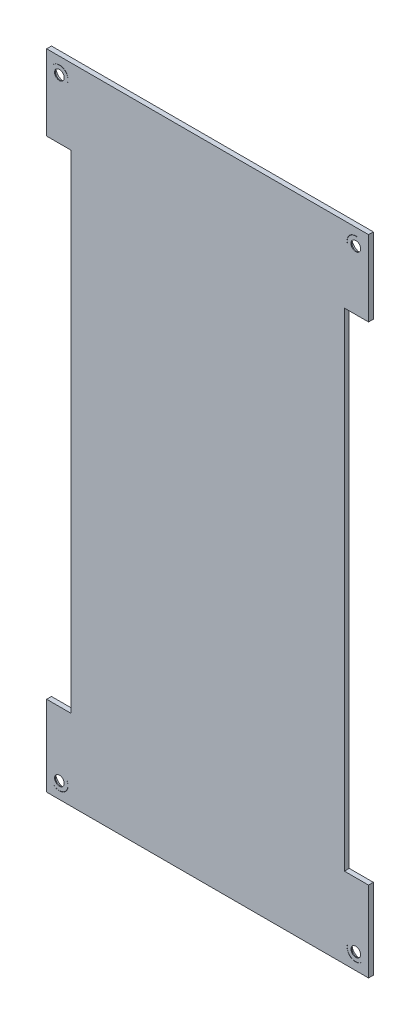
from build123d import *

# Parameters (mm, degrees)
SKETCH2_W           = 100
SKETCH2_H           = 200
BOSS_EXTRUDE1_DEPTH = 1.5
SKETCH4_R           = 2.667
CUT_EXTRUDE1_DEPTH  = 2
SKETCH5_R           = 2.667
SKETCH5_R_2         = 1.5
BOSS_EXTRUDE2_DEPTH = 0.254
SKETCH6_W           = 7.5
SKETCH6_H           = 150
CUT_EXTRUDE2_DEPTH  = 1.5
SKETCH7_W           = 7.5
SKETCH7_H           = 1.5
CUT_EXTRUDE3_DEPTH  = 1.5


with BuildPart() as part:
    # Sketch2 → Boss-Extrude1 (new body)
    with BuildSketch(Plane.XY):
        with Locations((50, 100)):
            Rectangle(SKETCH2_W, SKETCH2_H)
    extrude(amount=BOSS_EXTRUDE1_DEPTH)

    # Sketch4 → Cut-Extrude1 (cut)
    with BuildSketch(Plane.XY.offset(1.5)):
        with Locations((4, 195)):
            Circle(SKETCH4_R)
        with Locations((96, 195)):
            Circle(SKETCH4_R)
        with Locations((96, 5)):
            Circle(SKETCH4_R)
        with Locations((4, 5)):
            Circle(SKETCH4_R)
    extrude(amount=-CUT_EXTRUDE1_DEPTH, mode=Mode.SUBTRACT)

    # Sketch5 → Boss-Extrude2 (add)
    # profile 1 of 4: a face of its own
    with BuildSketch(Plane.XY.offset(1.5)):
        with Locations((3.959685834, 5.068811707)):
            Circle(SKETCH5_R)
        with Locations(Location((3.959685834, 5.068811707, 0), (0, 0, 180))):
            Circle(SKETCH5_R_2, mode=Mode.SUBTRACT)
    # profile 2 of 4: a face of its own
    with BuildSketch(Plane.XY.offset(1.5)):
        with Locations((3.959685834, 194.931188293)):
            Circle(SKETCH5_R)
        with Locations((3.959685834, 194.931188293)):
            Circle(SKETCH5_R_2, mode=Mode.SUBTRACT)
    # profile 3 of 4: a face of its own
    with BuildSketch(Plane.XY.offset(1.5)):
        with Locations((96.040314166, 5.068811707)):
            Circle(SKETCH5_R)
        with Locations((96.040314166, 5.068811707)):
            Circle(SKETCH5_R_2, mode=Mode.SUBTRACT)
    # profile 4 of 4: a face of its own
    with BuildSketch(Plane.XY.offset(1.5)):
        with Locations((96.040314166, 194.931188293)):
            Circle(SKETCH5_R)
        with Locations(Location((96.040314166, 194.931188293, 0), (0, 0, 180))):
            Circle(SKETCH5_R_2, mode=Mode.SUBTRACT)
    extrude(amount=-BOSS_EXTRUDE2_DEPTH)

    # Sketch6 → Cut-Extrude2 (cut)
    with BuildSketch(Plane.XY):
        with Locations((3.75, 100)):
            Rectangle(SKETCH6_W, SKETCH6_H)
        with Locations((96.25, 100)):
            Rectangle(SKETCH6_W, SKETCH6_H)
    extrude(amount=CUT_EXTRUDE2_DEPTH, mode=Mode.SUBTRACT)

    # Sketch7 → Cut-Extrude3 (cut)
    with BuildSketch(Plane.XZ.offset(-175)):
        with Locations((3.75, 0.75)):
            Rectangle(SKETCH7_W, SKETCH7_H)
        with Locations((96.25, 0.75)):
            Rectangle(SKETCH7_W, SKETCH7_H)
    extrude(amount=-CUT_EXTRUDE3_DEPTH, mode=Mode.SUBTRACT)


solid = part.part
